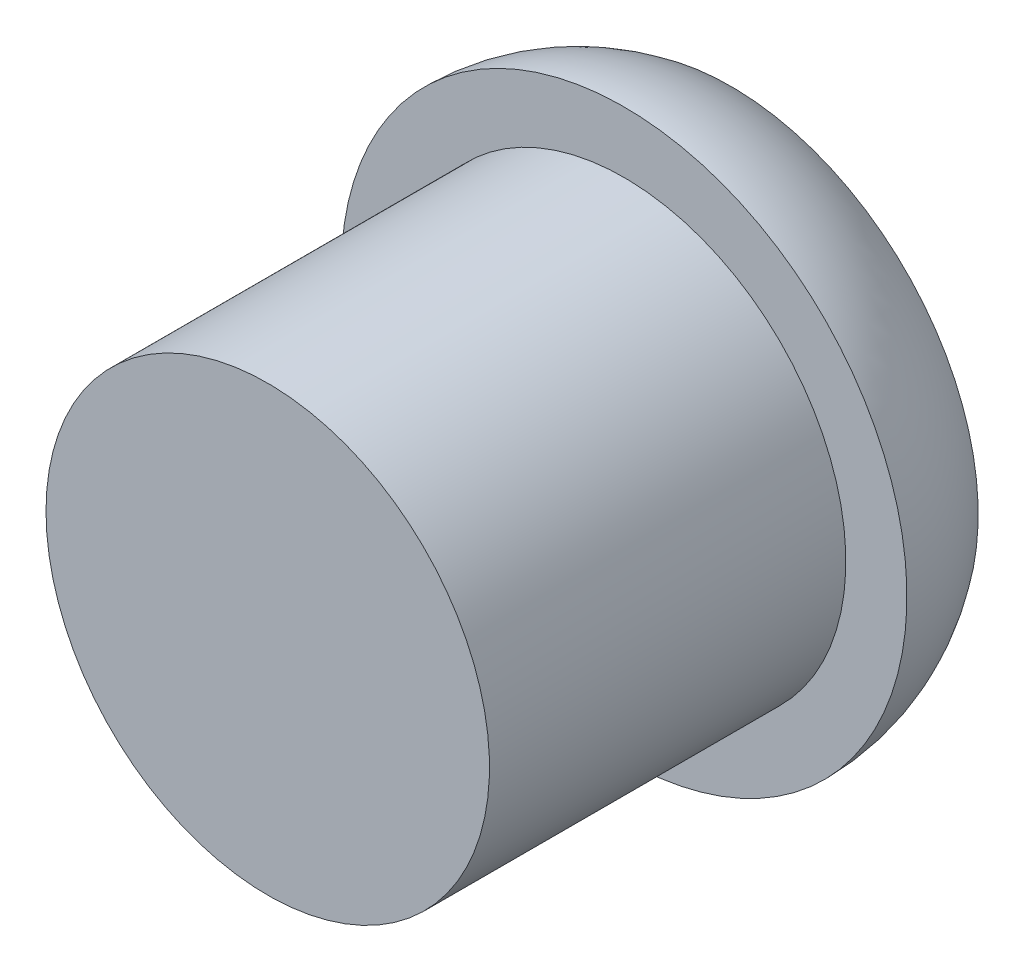
from build123d import *


with BuildPart() as part:
    # Sketch1 → Revolve1 (revolve)
    with BuildSketch(Plane(origin=(0, 0, 0), x_dir=(1, 0, 0), z_dir=(0, 1, 0)), mode=Mode.PRIVATE) as revolve1_sk:
        with BuildLine():
            Line((0, -10), (6.223, -10))
            Line((6.223, -10), (6.223, 0))
            Line((6.223, 0), (7.9375, 0))
            ThreePointArc((7.9375, 0), (7.68091649, 1.58113883), (6.9375, 3))
            Line((6.9375, 3), (6.244997998, 3))
            ThreePointArc((6.244997998, 3), (3.464101615, 5.211102551), (0, 6))
            Line((0, 6), (0, -10))
        make_face()
    revolve(revolve1_sk.sketch.rotate(Axis((0, 0, -6), (0, 0, 1)), 180), axis=Axis((0, 0, -6), (0, 0, 1)))


solid = part.part
